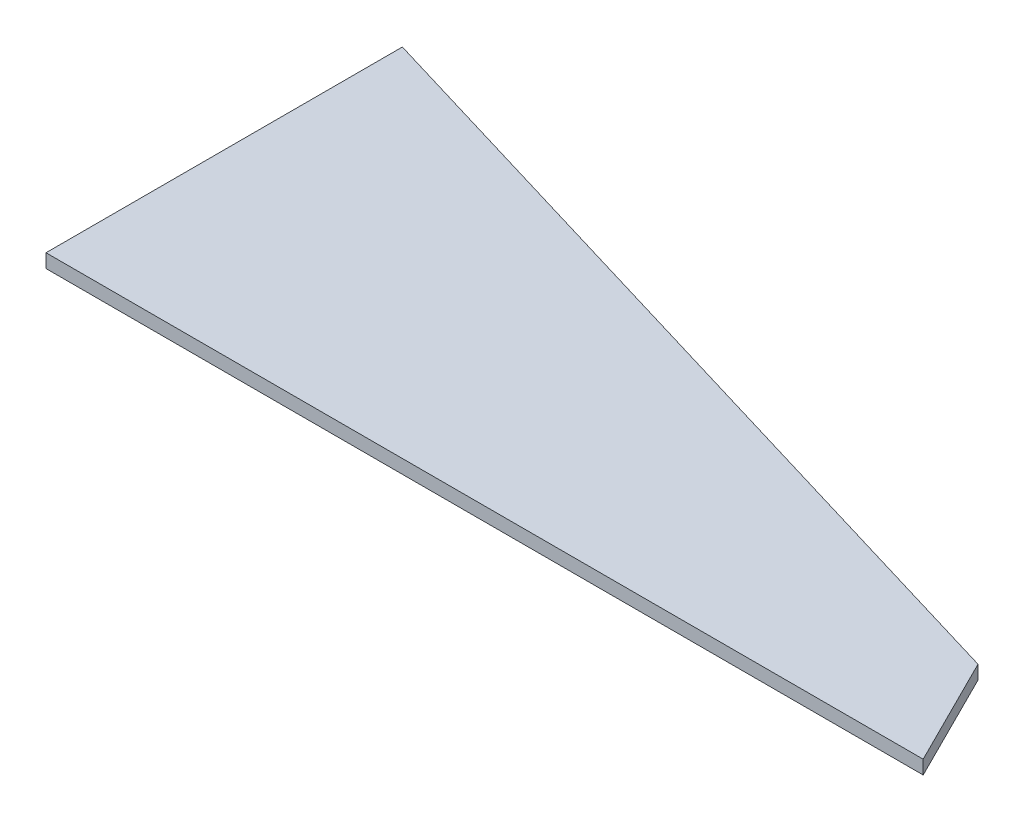
from build123d import *

# Parameters (mm, degrees)
BOSS_EXTRUDE1_DEPTH = 0.5


with BuildPart() as part:
    # Sketch1 → Boss-Extrude1 (new body)
    with BuildSketch(Plane(origin=(0, 0, 0), x_dir=(1, 0, 0), z_dir=(0, 1, 0))):
        Polygon((-22.4, -13), (9.6, -13), (7.6, -9), (-22.4, 0), align=None)
    extrude(amount=BOSS_EXTRUDE1_DEPTH)


solid = part.part
